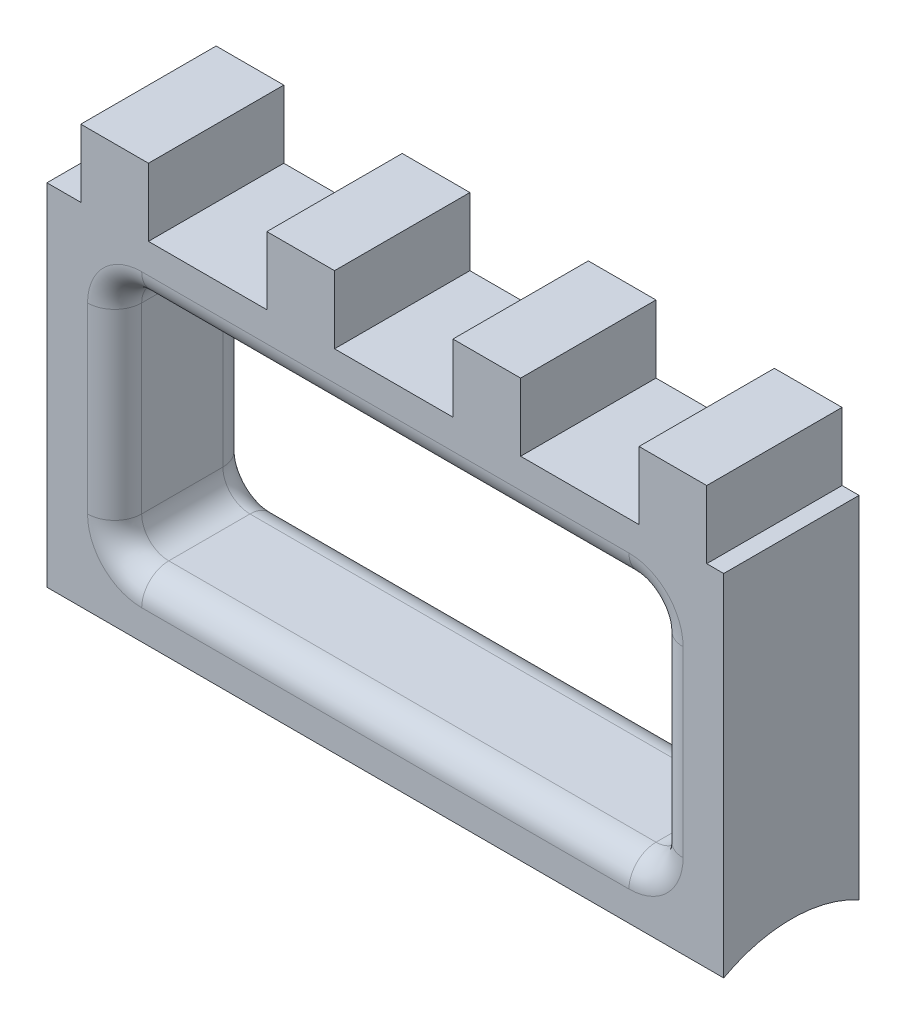
from build123d import *

# Parameters (mm, degrees)
SKETCH1_W             = 1.595
SKETCH1_H             = 12.7
BOSS_EXTRUDE1_DEPTH   = 6.35
SKETCH1_W_2           = 11.11
BOSS_EXTRUDE1_2_DEPTH = 6.35
BOSS_EXTRUDE1_3_DEPTH = 6.35
BOSS_EXTRUDE1_4_DEPTH = 6.35
SKETCH1_W_3           = 3.175
BOSS_EXTRUDE1_5_DEPTH = 6.35
SKETCH1_3_W           = 6.35
SKETCH1_3_H           = 12.7
BOSS_EXTRUDE2_DEPTH   = 12.7
SKETCH3_W             = 63.5
SKETCH3_H             = 12.7
BOSS_EXTRUDE3_DEPTH   = 38.1
CUT_EXTRUDE1_DEPTH    = 75.324844433
SKETCH5_W             = 50.8
SKETCH5_H             = 22.225
CUT_EXTRUDE2_DEPTH    = 44.273418952
FILLET1_R             = 2.54


with BuildPart() as part:
    # Sketch1 → Boss-Extrude1 (new body)
    with BuildSketch(Plane(origin=(0, 0, 0), x_dir=(1, 0, 0), z_dir=(0, 1, 0))):
        with Locations((30.9525, 0)):
            Rectangle(SKETCH1_W, SKETCH1_H)
    extrude(amount=BOSS_EXTRUDE1_DEPTH)



with BuildPart() as body_2:
    # Sketch1 → Boss-Extrude1 2 (new body)
    with BuildSketch(Plane(origin=(0, 0, 0), x_dir=(1, 0, 0), z_dir=(0, 1, 0))):
        with Locations((18.25, 0)):
            Rectangle(SKETCH1_W_2, SKETCH1_H)
    extrude(amount=BOSS_EXTRUDE1_2_DEPTH)


with BuildPart() as body_3:
    # Sketch1 → Boss-Extrude1 3 (new body)
    with BuildSketch(Plane(origin=(0, 0, 0), x_dir=(1, 0, 0), z_dir=(0, 1, 0))):
        with Locations((0.79, 0)):
            Rectangle(SKETCH1_W_2, SKETCH1_H)
    extrude(amount=BOSS_EXTRUDE1_3_DEPTH)


with BuildPart() as body_4:
    # Sketch1 → Boss-Extrude1 4 (new body)
    with BuildSketch(Plane(origin=(0, 0, 0), x_dir=(1, 0, 0), z_dir=(0, 1, 0))):
        with Locations((-16.67, 0)):
            Rectangle(SKETCH1_W_2, SKETCH1_H)
    extrude(amount=BOSS_EXTRUDE1_4_DEPTH)


with BuildPart() as body_5:
    # Sketch1 → Boss-Extrude1 5 (new body)
    with BuildSketch(Plane(origin=(0, 0, 0), x_dir=(1, 0, 0), z_dir=(0, 1, 0))):
        with Locations((-30.1625, 0)):
            Rectangle(SKETCH1_W_3, SKETCH1_H)
    extrude(amount=BOSS_EXTRUDE1_5_DEPTH)


with BuildPart() as part_1:
    add(part.part)

    add(body_2.part)  # Boss-Extrude2 merges body 2

    add(body_3.part)  # Boss-Extrude2 merges body 3

    add(body_4.part)  # Boss-Extrude2 merges body 4

    add(body_5.part)  # Boss-Extrude2 merges body 5
    # Sketch1<3> → Boss-Extrude2 (add)
    with BuildSketch(Plane(origin=(0, 0, 0), x_dir=(1, 0, 0), z_dir=(0, 1, 0))):
        with Locations((26.98, 0)):
            Rectangle(SKETCH1_3_W, SKETCH1_3_H)
        with Locations((9.52, 0)):
            Rectangle(SKETCH1_3_W, SKETCH1_3_H)
        with Locations((-7.94, 0)):
            Rectangle(SKETCH1_3_W, SKETCH1_3_H)
        with Locations((-25.4, 0)):
            Rectangle(SKETCH1_3_W, SKETCH1_3_H)
    extrude(amount=BOSS_EXTRUDE2_DEPTH)

    # Sketch3 → Boss-Extrude3 (add)
    with BuildSketch(Plane(origin=(0, 0, 0), x_dir=(-1, 0, 0), z_dir=(0, -1, 0))):
        Rectangle(SKETCH3_W, SKETCH3_H)
    extrude(amount=BOSS_EXTRUDE3_DEPTH)

    # Sketch4 → Cut-Extrude1 (cut, through all)
    with BuildSketch(Plane(origin=(31.75, 0, 0), x_dir=(0, 0, -1), z_dir=(1, 0, 0))):
        with BuildLine():
            Line((6.35, -26.518602675), (6.35, -38.1))
            Line((6.35, -38.1), (-6.35, -38.1))
            Line((-6.35, -38.1), (-6.35, -26.518602675))
            ThreePointArc((-6.35, -26.518602675), (0, -24.892), (6.35, -26.518602675))
        make_face()
    extrude(amount=-CUT_EXTRUDE1_DEPTH, mode=Mode.SUBTRACT)

    # Sketch5 → Cut-Extrude2 (cut, through all)
    with BuildSketch(Plane.XY.offset(6.35)):
        with Locations((0, -10.084301337)):
            Rectangle(SKETCH5_W, SKETCH5_H)
    extrude(amount=-CUT_EXTRUDE2_DEPTH, mode=Mode.SUBTRACT)

    # Fillet1
    fillet1_edges = [part_1.edges().sort_by_distance(p)[0] for p in [
        (25.4, -10.084301337, 6.35),
        (25.4, -10.084301337, -6.35),
        (0, -21.196801337, 6.35),
        (0, -21.196801337, -6.35),
        (-25.4, -10.084301337, -6.35),
        (-25.4, -10.084301337, 6.35),
        (0, 1.028198663, -6.35),
        (0, 1.028198663, 6.35),
        (-25.4, 1.028198663, 0),
        (-25.4, -21.196801337, 0),
        (25.4, -21.196801337, 0),
        (25.4, 1.028198663, 0),
    ]]
    fillet(fillet1_edges, radius=FILLET1_R)


solid = part_1.part
